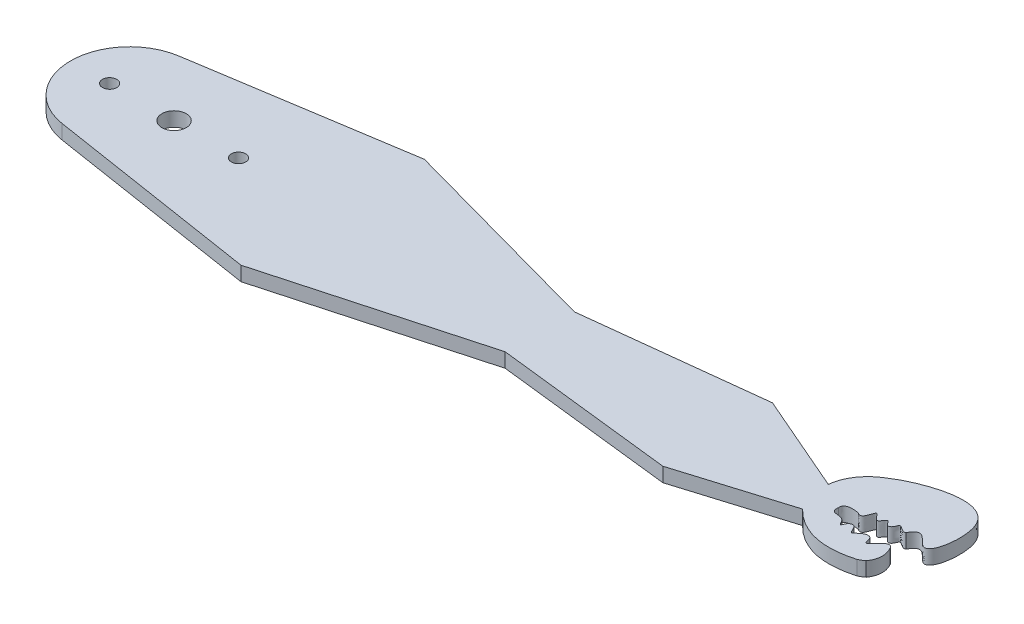
from build123d import *

# Parameters (mm, degrees)
SKETCH_3_R      = 1
SKETCH_3_R_2    = 1.7
EXTRUDE_1_DEPTH = 2


with BuildPart() as part:
    # 草图3 → 凸台-拉伸1 (new body)
    with BuildSketch(Plane(origin=(0, 0, 0), x_dir=(1, 0, 0), z_dir=(0, 1, 0))):
        with BuildLine():
            Line((-320.399473128, 12.806034348), (-291.479325537, 4.829502312))
            Line((-291.479325537, 4.829502312), (-266.640043075, 7.65970492))
            Line((-266.640043075, 7.65970492), (-252.877551864, 1.693647959))
            add(Edge.make_bspline(
                [(-252.877551864, 1.693647959), (-252.664865396, 3.896599527), (-251.139887534, 5.735724361), (-249.182494927, 6.768301737)],
                knots=[0, 0, 0, 0, 0.432417622, 0.432417622, 0.432417622, 0.432417622], degree=3))
            add(Edge.make_bspline(
                [(-249.182494927, 6.768301737), (-247.192125327, 8.122238326), (-235.338143075, 13.184917938), (-237.822398045, -2.352608844), (-240.590240104, 3.346622195), (-241.615045556, 1.27908511)],
                knots=[0, 0, 0, 0, 0.564814245, 0.840388037, 1, 1, 1, 1], degree=3))
            add(Edge.make_bspline(
                [(-241.615045556, 1.27908511), (-241.681380629, 1.245514563), (-242.133814553, 1.116888438), (-242.95107385, 2.141300114), (-243.120868984, 1.098314732), (-243.857318799, 0.57131474), (-244.368676704, 2.049764447), (-245.089398939, 0.004071963), (-246.354001067, 2.868241481), (-246.334398055, -0.367123123), (-247.311242473, 0.323468446)],
                knots=[0.107490651, 0.107490651, 0.107490651, 0.107490651, 0.132483797, 0.269585072, 0.342843538, 0.409355267, 0.511314135, 0.627417889, 0.767319287, 1, 1, 1, 1], degree=3))
            add(Edge.make_bspline(
                [(-247.311242473, 0.323468446), (-247.707130946, 0.437949002), (-249.5301806, 0.685883331), (-249.357187857, -0.418676387)],
                knots=[0, 0, 0, 0, 1, 1, 1, 1], degree=3))
            add(Edge.make_bspline(
                [(-249.357187857, -0.418676387), (-249.515917866, -1.804607681), (-247.835383275, -0.679037527), (-247.112423771, -2.73891734), (-246.900381915, -1.545387145), (-245.789823545, -1.292164149), (-245.566979662, -2.990738082), (-244.7209859, -1.80283183), (-243.355713317, -1.416571022), (-243.326864122, -3.262504141), (-242.224201897, -1.797301053), (-241.169388438, -0.96078114), (-240.807899843, -1.800354973)],
                knots=[0, 0, 0, 0, 0.201320625, 0.267960622, 0.329698953, 0.388790042, 0.491585355, 0.554912386, 0.664186638, 0.739490632, 0.844130374, 0.967687023, 0.967687023, 0.967687023, 0.967687023], degree=3))
            add(Edge.make_bspline(
                [(-240.807899843, -1.800354973), (-239.966931467, -3.391995655), (-240.997103543, -4.891342708)],
                knots=[0, 0, 0, 1, 1, 1], degree=2))
            add(Edge.make_bspline(
                [(-241.821631268, -5.375257485), (-241.643156571, -5.309389423), (-241.312545455, -5.12610139), (-240.997103543, -4.891342708)],
                knots=[0, 0, 0, 0, 0.023628287, 0.023628287, 0.023628287, 0.023628287], degree=3))
            add(Edge.make_bspline(
                [(-251.696075382, -3.089393708), (-249.084673797, -5.749561221), (-245.793192426, -6.511515813), (-241.821631268, -5.375257485)],
                knots=[0.135882265, 0.135882265, 0.135882265, 0.135882265, 1, 1, 1, 1], degree=3))
            Line((-251.696075382, -3.089393708), (-266.640021363, -7.659775915))
            Line((-266.640021363, -7.659775915), (-291.479303823, -4.829573296))
            Line((-291.479303823, -4.829573296), (-320.399451417, -12.80610532))
            Line((-320.399451417, -12.80610532), (-350.037238296, -8.158175504))
            ThreePointArc((-350.037238296, -8.158175504), (-357.015694836, -3.3775e-05), (-350.037238292, 8.15810795))
            Line((-350.037238292, 8.15810795), (-320.399473128, 12.806034348))
        make_face()
        with Locations(Location((-351.550226026, 0, 0), (0, 0, 270))):
            Circle(SKETCH_3_R, mode=Mode.SUBTRACT)
        with Locations(Location((-342.550226026, 0, 0), (0, 0, 270))):
            Circle(SKETCH_3_R_2, mode=Mode.SUBTRACT)
        with Locations(Location((-333.550226026, 0, 0), (0, 0, 90))):
            Circle(SKETCH_3_R, mode=Mode.SUBTRACT)
    extrude(amount=EXTRUDE_1_DEPTH)


solid = part.part
